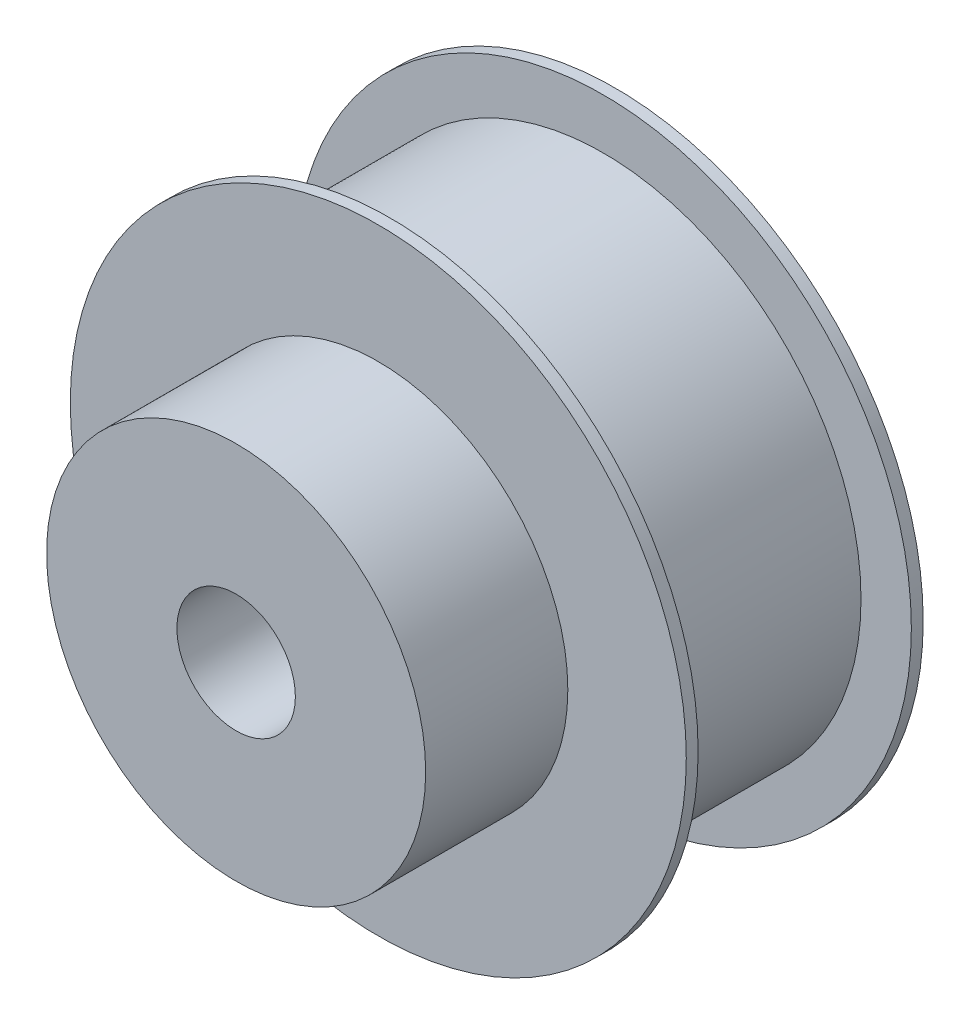
from build123d import *

# Parameters (mm, degrees)
ESQUISSE1_R      = 13
EXTRUSION1_DEPTH = 0.5
ESQUISSE2_R      = 10.875
EXTRUSION2_DEPTH = 9
ESQUISSE3_R      = 13
EXTRUSION3_DEPTH = 0.5
ESQUISSE4_R      = 8
EXTRUSION4_DEPTH = 6
ESQUISSE5_R      = 2.5
EXTRUSION5_DEPTH = 25.372115214


with BuildPart() as part:
    # Esquisse1 → Extrusion1 (new body)
    with BuildSketch(Plane.XY):
        Circle(ESQUISSE1_R)
    extrude(amount=EXTRUSION1_DEPTH)

    # Esquisse2 → Extrusion2 (add)
    with BuildSketch(Plane.XY.offset(0.5)):
        Circle(ESQUISSE2_R)
    extrude(amount=EXTRUSION2_DEPTH)

    # Esquisse3 → Extrusion3 (add)
    with BuildSketch(Plane.XY.offset(9.5)):
        Circle(ESQUISSE3_R)
    extrude(amount=EXTRUSION3_DEPTH)

    # Esquisse4 → Extrusion4 (add)
    with BuildSketch(Plane.XY.offset(10)):
        Circle(ESQUISSE4_R)
    extrude(amount=EXTRUSION4_DEPTH)

    # Esquisse5 → Extrusion5 (cut, through all)
    with BuildSketch(Plane.XY.offset(16)):
        Circle(ESQUISSE5_R)
    extrude(amount=-EXTRUSION5_DEPTH, mode=Mode.SUBTRACT)


solid = part.part
